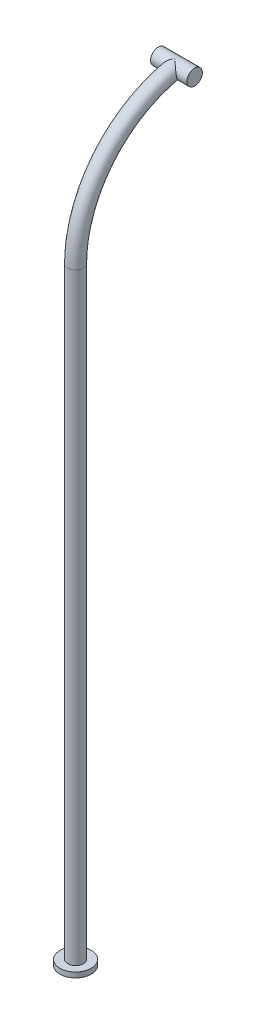
from build123d import *

# Parameters (mm, degrees)
SKETCH1_R                = 1.5
BOSS_EXTRUDE1_DEPTH      = 116
SKETCH4_R                = 3
BOSS_EXTRUDE4_DEPTH      = 1
SKETCH7_R                = 1.5000000000000002
REVOLVE1_ANGLE           = 80.00000000000017
BOSS_EXTRUDE5_DEPTH      = 3.5
BOSS_EXTRUDE5_DEPTH_BACK = 3.5
SKETCH8_R                = 1.5000000000000009


with BuildPart() as part:
    # Sketch1 → Boss-Extrude1 (new body)
    with BuildSketch(Plane(origin=(0, 0, 0), x_dir=(1, 0, 0), z_dir=(0, 1, 0))):
        Circle(SKETCH1_R)
    extrude(amount=BOSS_EXTRUDE1_DEPTH)

    # Sketch4 → Boss-Extrude4 (add)
    with BuildSketch(Plane.XZ):
        Circle(SKETCH4_R)
    extrude(amount=BOSS_EXTRUDE4_DEPTH)

    # Sketch7 → Revolve1 (revolve)
    with BuildSketch(Plane(origin=(0, 116, 0), x_dir=(1, 0, 0), z_dir=(0, 1, 0))):
        Circle(SKETCH7_R)
    revolve(axis=Axis((-42.51012264816653, 116, -23.499999999999993), (-1, 0, 8e-17)), revolution_arc=REVOLVE1_ANGLE)

    # Sketch8 → Boss-Extrude5 (add, two sides: drawn at the far end of the back side and taken through both)
    with BuildSketch(Plane(origin=(0, 0, 0), x_dir=(0, 0, -1), z_dir=(1, 0, 0)).offset(-BOSS_EXTRUDE5_DEPTH_BACK)):
        with Locations((19.41926782482721, 139.14298219578689)):
            Circle(SKETCH8_R)
    extrude(amount=BOSS_EXTRUDE5_DEPTH + BOSS_EXTRUDE5_DEPTH_BACK)


solid = part.part
